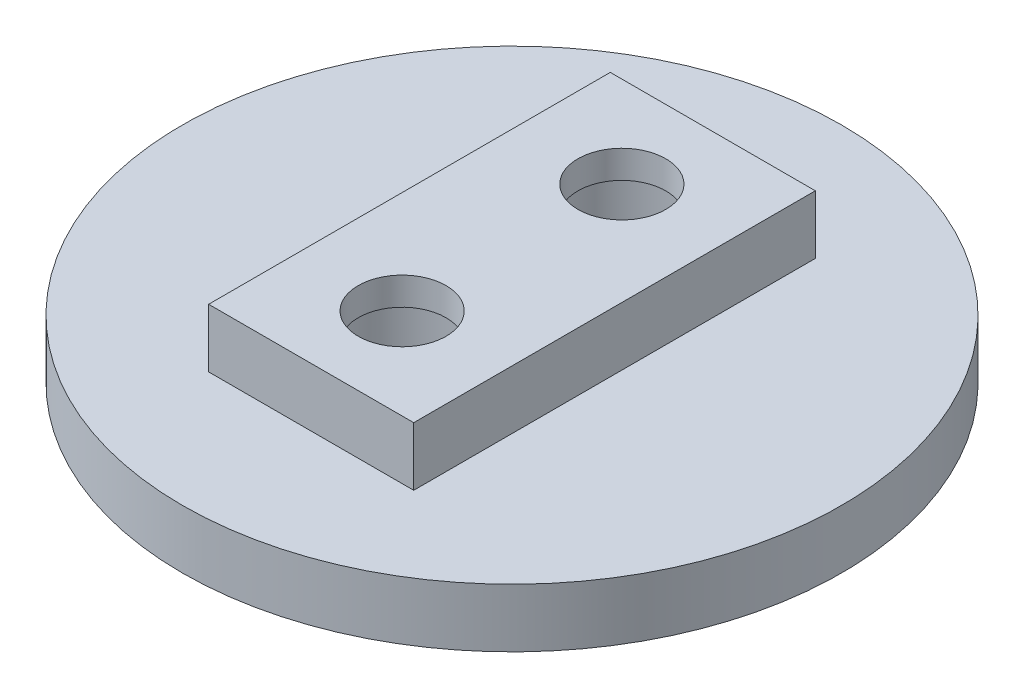
from build123d import *

# Parameters (mm, degrees)
SKETCH2_R           = 22.5
BOSS_EXTRUDE1_DEPTH = 4
SKETCH3_W           = 14
SKETCH3_H           = 27.42
BOSS_EXTRUDE2_DEPTH = 4
SKETCH4_R           = 3
CUT_EXTRUDE1_DEPTH  = 33.810059433
SKETCH5_R           = 5
CUT_EXTRUDE2_DEPTH  = 6.1


with BuildPart() as part:
    # Sketch2 → Boss-Extrude1 (new body)
    with BuildSketch(Plane(origin=(0, 0, 0), x_dir=(1, 0, 0), z_dir=(0, 1, 0))):
        with Locations(Location((0, 0, 0), (0, 0, 270))):
            Circle(SKETCH2_R)
    extrude(amount=BOSS_EXTRUDE1_DEPTH)

    # Sketch3 → Boss-Extrude2 (add)
    with BuildSketch(Plane(origin=(0, 4, 0), x_dir=(1, 0, 0), z_dir=(0, 1, 0))):
        Rectangle(SKETCH3_W, SKETCH3_H)
    extrude(amount=BOSS_EXTRUDE2_DEPTH)

    # Sketch4 → Cut-Extrude1 (cut, through all)
    with BuildSketch(Plane(origin=(0, 8, 0), x_dir=(1, 0, 0), z_dir=(0, 1, 0))):
        with Locations(Location((0, 7.5, 0), (0, 0, 270))):
            Circle(SKETCH4_R)
        with Locations(Location((0, -7.5, 0), (0, 0, 90))):
            Circle(SKETCH4_R)
    extrude(amount=-CUT_EXTRUDE1_DEPTH, mode=Mode.SUBTRACT)

    # Sketch5 → Cut-Extrude2 (cut)
    with BuildSketch(Plane.XZ):
        with Locations(Location((0, 7.5, 0), (0, 0, 270))):
            Circle(SKETCH5_R)
        with Locations(Location((0, -7.5, 0), (0, 0, 90))):
            Circle(SKETCH5_R)
    extrude(amount=-CUT_EXTRUDE2_DEPTH, mode=Mode.SUBTRACT)


solid = part.part
